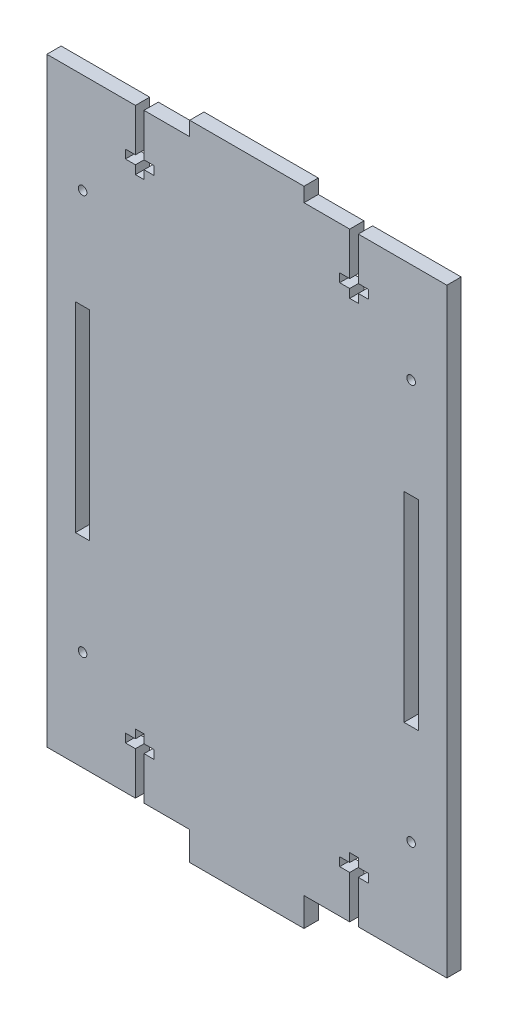
from build123d import *

# Parameters (mm, degrees)
CROQUIS1_R              = 1.5
CROQUIS1_W              = 5
CROQUIS1_H              = 70
SALIENTE_EXTRUIR1_DEPTH = 5


with BuildPart() as part:
    # Croquis1 → Saliente-Extruir1 (new body)
    with BuildSketch(Plane.XY):
        Polygon((0, 0), (31, 0), (31, 15), (27.5, 15), (27.5, 18), (31, 18), (31, 21), (34, 21), (34, 18), (37.5, 18), (37.5, 15), (34, 15), (34, 0), (50, 0), (50, -10), (90, -10), (90, 0), (106, 0), (106, 15), (102.5, 15), (102.5, 18), (106, 18), (106, 21), (109, 21), (109, 18), (112.5, 18), (112.5, 15), (109, 15), (109, 0), (140, 0), (140, 210), (109, 210), (109, 195), (112.5, 195), (112.5, 192), (109, 192), (109, 189), (106, 189), (106, 192), (102.5, 192), (102.5, 195), (106, 195), (106, 210), (90, 210), (90, 215), (50, 215), (50, 210), (34, 210), (34, 195), (37.5, 195), (37.5, 192), (34, 192), (34, 189), (31, 189), (31, 192), (27.5, 192), (27.5, 195), (31, 195), (31, 210), (0, 210), align=None)
        with Locations((12.5, 175)):
            Circle(CROQUIS1_R, mode=Mode.SUBTRACT)
        with Locations(Location((12.5, 35, 0), (0, 0, 180))):
            Circle(CROQUIS1_R, mode=Mode.SUBTRACT)
        with Locations(Location((127.5, 175, 0), (0, 0, 180))):
            Circle(CROQUIS1_R, mode=Mode.SUBTRACT)
        with Locations((127.5, 35)):
            Circle(CROQUIS1_R, mode=Mode.SUBTRACT)
        with Locations((127.5, 105)):
            Rectangle(CROQUIS1_W, CROQUIS1_H, mode=Mode.SUBTRACT)
        with Locations((12.5, 105)):
            Rectangle(CROQUIS1_W, CROQUIS1_H, mode=Mode.SUBTRACT)
    extrude(amount=SALIENTE_EXTRUIR1_DEPTH)


solid = part.part
